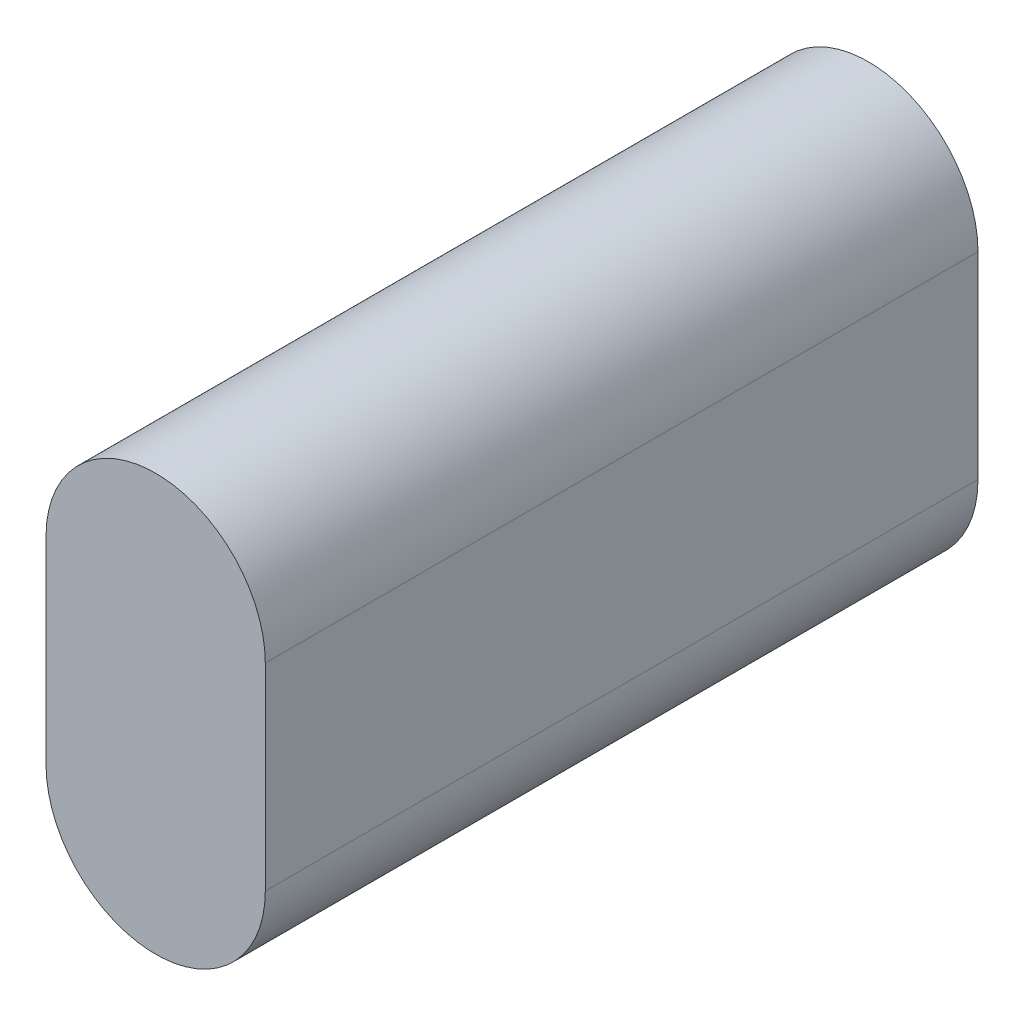
from build123d import *

# Parameters (mm, degrees)
EXTRUDE_1_DEPTH = 65


with BuildPart() as part:
    # 草图1 → 凸台-拉伸1 (new body)
    with BuildSketch(Plane.XY):
        with BuildLine():
            Line((10, 9), (10, -9))
            ThreePointArc((10, -9), (0, -19), (-10, -9))
            Line((-10, -9), (-10, 9))
            ThreePointArc((-10, 9), (0, 19), (10, 9))
        make_face()
    extrude(amount=EXTRUDE_1_DEPTH)


solid = part.part
